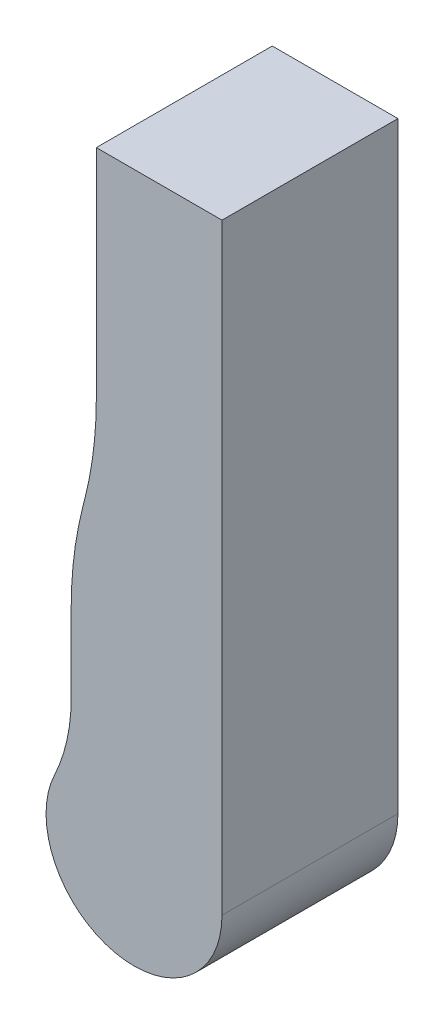
from build123d import *

# Parameters (mm, degrees)
BOSS_EXTRU_2_DEPTH = 7
CONG_1_R           = 7
CONG_2_R           = 15


with BuildPart() as part:
    # Esquisse1 → Boss.-Extru.2 (new body)
    with BuildSketch(Plane.XY):
        with BuildLine():
            Line((-5, 0), (-5, -10.5))
            Line((-5, -10.5), (-6, -14.5))
            Line((-6, -14.5), (-6, -21.5))
            ThreePointArc((-6, -21.5), (-4.822875656, -27.189860092), (0, -23.949489743))
            Line((0, -23.949489743), (0, 0))
            Line((0, 0), (-5, 0))
        make_face()
    extrude(amount=BOSS_EXTRU_2_DEPTH)

    # Congé1
    cong_1_edges = [part.edges().sort_by_distance(p)[0] for p in [
        (-6, -21.5, 3.5),
    ]]
    fillet(cong_1_edges, radius=CONG_1_R)

    # Congé2
    cong_2_edges = [part.edges().sort_by_distance(p)[0] for p in [
        (-6, -14.5, 3.5),
        (-5, -10.5, 3.5),
    ]]
    fillet(cong_2_edges, radius=CONG_2_R)


solid = part.part
